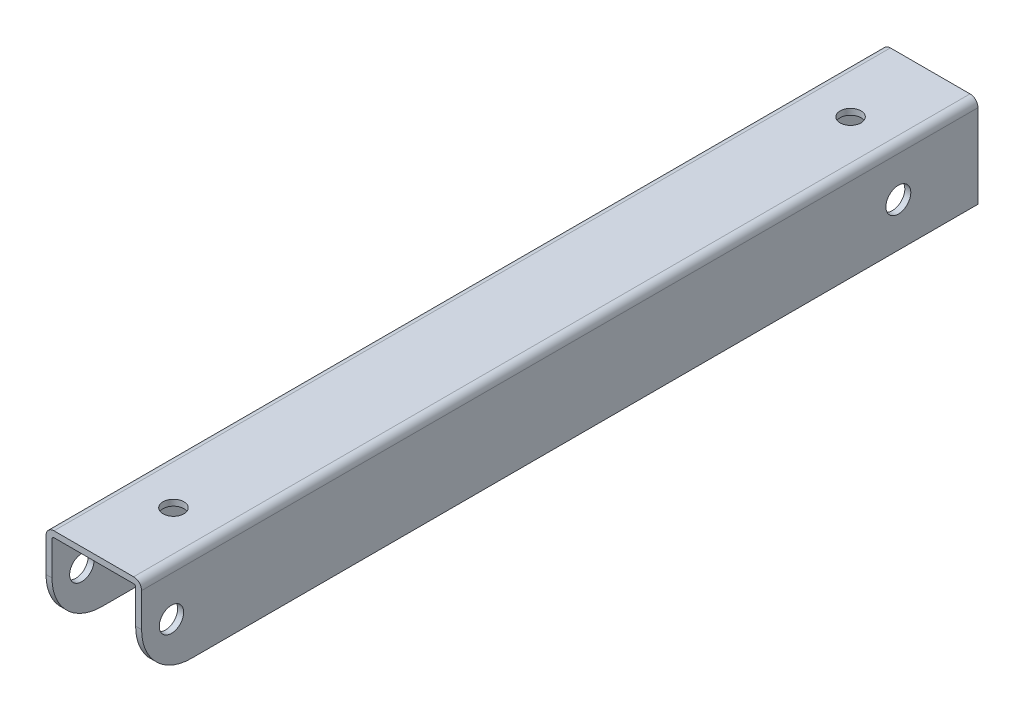
from build123d import *

# Parameters (mm, degrees)
EKSTR_ZYON_NCE10_DEPTH                = 420
M12_HELISARMAL_I_IN_Z_VANA_MATKAB_1_D = 12.5
M12_HELISARMAL_I_IN_Z_VANA_MATKAB_2_D = 12.25
M10_HELISARMAL_I_IN_Z_VANA_MATKAB_1_D = 10.5
RADYUS1_R                             = 25
RADYUS2_R                             = 25


with BuildPart() as part:
    # Çizim1 → Ekstrüzyon-İnce10 (new body)
    with BuildSketch(Plane.XY):
        with BuildLine():
            Line((-37.044551646, -1.625), (-37.044551646, 40.375))
            ThreePointArc((-37.044551646, 40.375), (-36.751658427, 41.082106781), (-36.044551646, 41.375))
            Line((-36.044551646, 41.375), (3.955448354, 41.375))
            ThreePointArc((3.955448354, 41.375), (4.662555135, 41.082106781), (4.955448354, 40.375))
            Line((4.955448354, 40.375), (4.955448354, -1.625))
            Line((4.955448354, -1.625), (7.955448354, -1.625))
            Line((7.955448354, -1.625), (7.955448354, 40.375))
            ThreePointArc((7.955448354, 40.375), (6.783875479, 43.203427125), (3.955448354, 44.375))
            Line((3.955448354, 44.375), (-36.044551646, 44.375))
            ThreePointArc((-36.044551646, 44.375), (-38.872978771, 43.203427125), (-40.044551646, 40.375))
            Line((-40.044551646, 40.375), (-40.044551646, -1.625))
            Line((-40.044551646, -1.625), (-37.044551646, -1.625))
        make_face()
    extrude(amount=EKSTR_ZYON_NCE10_DEPTH)

    # M12 Helisarmal için Zıvana matkabı1 (through all)
    with Locations(Plane.ZY.offset(40.044551646)):
        with Locations((40, 20.375)):
            Hole(M12_HELISARMAL_I_IN_Z_VANA_MATKAB_1_D / 2)

    # M12 Helisarmal için Zıvana matkabı2 (through all)
    with Locations(Plane.ZY.offset(40.044551646)):
        with Locations((405, 20.375)):
            Hole(M12_HELISARMAL_I_IN_Z_VANA_MATKAB_2_D / 2)

    # M10 Helisarmal için Zıvana matkabı1 (through all)
    with Locations(Plane(origin=(-16.044551646, 44.375, 380), x_dir=(0, 0, 1), z_dir=(0, 1, 0))):
        with Locations((0, 0), (-340, 0)):
            Hole(M10_HELISARMAL_I_IN_Z_VANA_MATKAB_1_D / 2)

    # Radyus1
    radyus1_edges = [part.edges().sort_by_distance(p)[0] for p in [
        (-38.544551646, -1.625, 420),
    ]]
    fillet(radyus1_edges, radius=RADYUS1_R)

    # Radyus2
    radyus2_edges = [part.edges().sort_by_distance(p)[0] for p in [
        (6.455448354, -1.625, 420),
    ]]
    fillet(radyus2_edges, radius=RADYUS2_R)


solid = part.part
